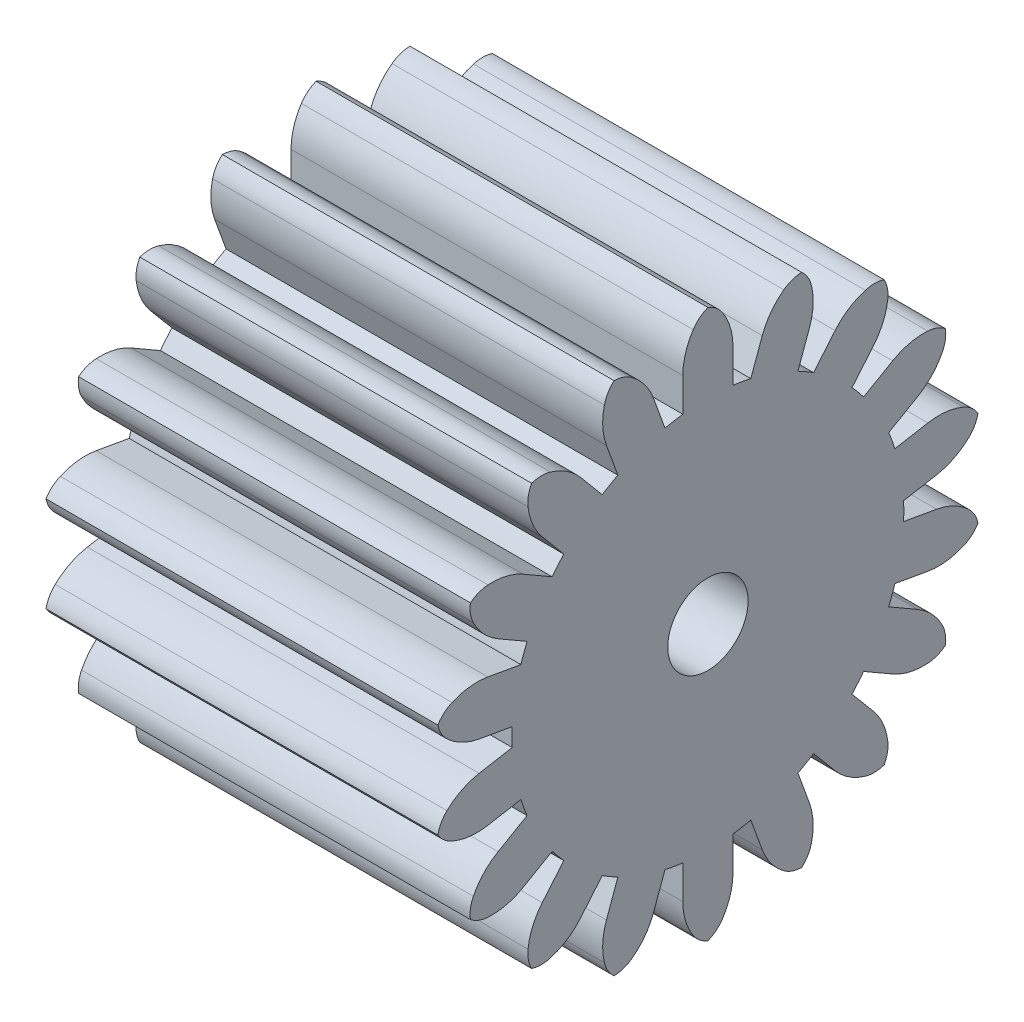
from build123d import *

# Parameters (mm, degrees)
SKETCH1_R           = 5
SKETCH1_R_2         = 1.025
BOSS_EXTRUDE1_DEPTH = 10


with BuildPart() as part:
    # Sketch1 → Boss-Extrude1 (new body)
    # profile 1 of 20: a face of its own
    with BuildSketch(Plane(origin=(0, 0, 0), x_dir=(0, 0, -1), z_dir=(1, 0, 0))):
        Circle(SKETCH1_R)
        Circle(SKETCH1_R_2, mode=Mode.SUBTRACT)
    # profile 2 of 20: a face of its own
    with BuildSketch(Plane(origin=(0, 0, 0), x_dir=(0, 0, -1), z_dir=(1, 0, 0))):
        with BuildLine():
            ThreePointArc((-3.677769177, 3.38733138), (-3.213938048, 3.830222216), (-2.69723229, 4.210099521))
            Line((-2.69723229, 4.210099521), (-3.247176685, 4.86549773))
            ThreePointArc((-3.247176685, 4.86549773), (-3.59498536, 5.174706252), (-4.017062837, 5.370745503))
            ThreePointArc((-4.017062837, 5.370745503), (-4.258939115, 5.403769303), (-4.499513268, 5.362311102))
            ThreePointArc((-4.499513268, 5.362311102), (-4.582116889, 5.132590952), (-4.59159617, 4.888654796))
            ThreePointArc((-4.59159617, 4.888654796), (-4.47182818, 4.438947765), (-4.227713572, 4.042729589))
            Line((-4.227713572, 4.042729589), (-3.677769177, 3.38733138))
        make_face()
    # profile 3 of 20: a face of its own
    with BuildSketch(Plane(origin=(0, 0, 0), x_dir=(0, 0, -1), z_dir=(1, 0, 0))):
        with BuildLine():
            ThreePointArc((-2.297436992, 4.440921443), (-1.710100717, 4.698463104), (-1.094630438, 4.878707227))
            Line((-1.094630438, 4.878707227), (-1.387249739, 5.682672148))
            ThreePointArc((-1.387249739, 5.682672148), (-1.60832744, 6.092190688), (-1.937901159, 6.420766325))
            ThreePointArc((-1.937901159, 6.420766325), (-2.153895708, 6.534525105), (-2.394141003, 6.577848346))
            ThreePointArc((-2.394141003, 6.577848346), (-2.550331935, 6.390234118), (-2.642670624, 6.164251217))
            ThreePointArc((-2.642670624, 6.164251217), (-2.683934392, 5.700701774), (-2.590056293, 5.244886365))
            Line((-2.590056293, 5.244886365), (-2.297436992, 4.440921443))
        make_face()
    # profile 4 of 20: a face of its own
    with BuildSketch(Plane(origin=(0, 0, 0), x_dir=(0, 0, -1), z_dir=(1, 0, 0))):
        with BuildLine():
            Line((1.387249739, 5.682672148), (1.094630438, 4.878707227))
            ThreePointArc((1.094630438, 4.878707227), (1.710100717, 4.698463104), (2.297436992, 4.440921443))
            Line((2.297436992, 4.440921443), (2.590056293, 5.244886365))
            ThreePointArc((2.590056293, 5.244886365), (2.683934392, 5.700701774), (2.642670624, 6.164251217))
            ThreePointArc((2.642670624, 6.164251217), (2.550331935, 6.390234118), (2.394141003, 6.577848346))
            ThreePointArc((2.394141003, 6.577848346), (2.153895708, 6.534525105), (1.937901159, 6.420766325))
            ThreePointArc((1.937901159, 6.420766325), (1.60832744, 6.092190688), (1.387249739, 5.682672148))
        make_face()
    # profile 5 of 20: a face of its own
    with BuildSketch(Plane(origin=(0, 0, 0), x_dir=(0, 0, -1), z_dir=(1, 0, 0))):
        with BuildLine():
            Line((3.247176685, 4.86549773), (2.69723229, 4.210099521))
            ThreePointArc((2.69723229, 4.210099521), (3.213938048, 3.830222216), (3.677769177, 3.38733138))
            Line((3.677769177, 3.38733138), (4.227713572, 4.042729589))
            ThreePointArc((4.227713572, 4.042729589), (4.47182818, 4.438947765), (4.59159617, 4.888654796))
            ThreePointArc((4.59159617, 4.888654796), (4.582116889, 5.132590952), (4.499513268, 5.362311102))
            ThreePointArc((4.499513268, 5.362311102), (4.258939115, 5.403769303), (4.017062837, 5.370745503))
            ThreePointArc((4.017062837, 5.370745503), (3.59498536, 5.174706252), (3.247176685, 4.86549773))
        make_face()
    # profile 6 of 20: a face of its own
    with BuildSketch(Plane(origin=(0, 0, 0), x_dir=(0, 0, -1), z_dir=(1, 0, 0))):
        with BuildLine():
            Line((4.7154462, 3.461472478), (3.974508121, 3.033691678))
            ThreePointArc((3.974508121, 3.033691678), (4.330127019, 2.5), (4.614508121, 1.925179161))
            Line((4.614508121, 1.925179161), (5.3554462, 2.352959961))
            ThreePointArc((5.3554462, 2.352959961), (5.720353493, 2.641791144), (5.986707452, 3.023414457))
            ThreePointArc((5.986707452, 3.023414457), (6.061230921, 3.255881569), (6.062177826, 3.5))
            ThreePointArc((6.062177826, 3.5), (5.85029161, 3.621239171), (5.611707452, 3.67293351))
            ThreePointArc((5.611707452, 3.67293351), (5.148034989, 3.633075872), (4.7154462, 3.461472478))
        make_face()
    # profile 7 of 20: a face of its own
    with BuildSketch(Plane(origin=(0, 0, 0), x_dir=(0, 0, -1), z_dir=(1, 0, 0))):
        with BuildLine():
            Line((5.614963311, 1.639942559), (4.772399615, 1.491375846))
            ThreePointArc((4.772399615, 1.491375846), (4.924038765, 0.868240888), (4.994669282, 0.230821923))
            Line((4.994669282, 0.230821923), (5.837232978, 0.379388635))
            ThreePointArc((5.837232978, 0.379388635), (6.278919752, 0.525995522), (6.659733462, 0.793505714))
            ThreePointArc((6.659733462, 0.793505714), (6.80927105, 0.986464816), (6.893654271, 1.215537244))
            ThreePointArc((6.893654271, 1.215537244), (6.736012596, 1.401934152), (6.529497328, 1.532111529))
            ThreePointArc((6.529497328, 1.532111529), (6.080155621, 1.653242923), (5.614963311, 1.639942559))
        make_face()
    # profile 8 of 20: a face of its own
    with BuildSketch(Plane(origin=(0, 0, 0), x_dir=(0, 0, -1), z_dir=(1, 0, 0))):
        with BuildLine():
            Line((5.837232978, -0.379388635), (4.994669282, -0.230821923))
            ThreePointArc((4.994669282, -0.230821923), (4.924038765, -0.868240888), (4.772399615, -1.491375846))
            Line((4.772399615, -1.491375846), (5.614963311, -1.639942559))
            ThreePointArc((5.614963311, -1.639942559), (6.080155621, -1.653242923), (6.529497328, -1.532111529))
            ThreePointArc((6.529497328, -1.532111529), (6.736012596, -1.401934152), (6.893654271, -1.215537244))
            ThreePointArc((6.893654271, -1.215537244), (6.80927105, -0.986464816), (6.659733462, -0.793505714))
            ThreePointArc((6.659733462, -0.793505714), (6.278919752, -0.525995522), (5.837232978, -0.379388635))
        make_face()
    # profile 9 of 20: a face of its own
    with BuildSketch(Plane(origin=(0, 0, 0), x_dir=(0, 0, -1), z_dir=(1, 0, 0))):
        with BuildLine():
            Line((5.3554462, -2.352959961), (4.614508121, -1.925179161))
            ThreePointArc((4.614508121, -1.925179161), (4.330127019, -2.5), (3.974508121, -3.033691678))
            Line((3.974508121, -3.033691678), (4.7154462, -3.461472478))
            ThreePointArc((4.7154462, -3.461472478), (5.148034989, -3.633075872), (5.611707452, -3.67293351))
            ThreePointArc((5.611707452, -3.67293351), (5.85029161, -3.621239171), (6.062177826, -3.5))
            ThreePointArc((6.062177826, -3.5), (6.061230921, -3.255881569), (5.986707452, -3.023414457))
            ThreePointArc((5.986707452, -3.023414457), (5.720353493, -2.641791144), (5.3554462, -2.352959961))
        make_face()
    # profile 10 of 20: a face of its own
    with BuildSketch(Plane(origin=(0, 0, 0), x_dir=(0, 0, -1), z_dir=(1, 0, 0))):
        with BuildLine():
            Line((4.227713572, -4.042729589), (3.677769177, -3.38733138))
            ThreePointArc((3.677769177, -3.38733138), (3.213938048, -3.830222216), (2.69723229, -4.210099521))
            Line((2.69723229, -4.210099521), (3.247176685, -4.86549773))
            ThreePointArc((3.247176685, -4.86549773), (3.59498536, -5.174706252), (4.017062837, -5.370745503))
            ThreePointArc((4.017062837, -5.370745503), (4.258939115, -5.403769303), (4.499513268, -5.362311102))
            ThreePointArc((4.499513268, -5.362311102), (4.582116889, -5.132590952), (4.59159617, -4.888654796))
            ThreePointArc((4.59159617, -4.888654796), (4.47182818, -4.438947765), (4.227713572, -4.042729589))
        make_face()
    # profile 11 of 20: a face of its own
    with BuildSketch(Plane(origin=(0, 0, 0), x_dir=(0, 0, -1), z_dir=(1, 0, 0))):
        with BuildLine():
            Line((2.590056293, -5.244886365), (2.297436992, -4.440921443))
            ThreePointArc((2.297436992, -4.440921443), (1.710100717, -4.698463104), (1.094630438, -4.878707227))
            Line((1.094630438, -4.878707227), (1.387249739, -5.682672148))
            ThreePointArc((1.387249739, -5.682672148), (1.60832744, -6.092190688), (1.937901159, -6.420766325))
            ThreePointArc((1.937901159, -6.420766325), (2.153895708, -6.534525105), (2.394141003, -6.577848346))
            ThreePointArc((2.394141003, -6.577848346), (2.550331935, -6.390234118), (2.642670624, -6.164251217))
            ThreePointArc((2.642670624, -6.164251217), (2.683934392, -5.700701774), (2.590056293, -5.244886365))
        make_face()
    # profile 12 of 20: a face of its own
    with BuildSketch(Plane(origin=(0, 0, 0), x_dir=(0, 0, -1), z_dir=(1, 0, 0))):
        with BuildLine():
            ThreePointArc((0.64, -4.958870839), (0, -5), (-0.64, -4.958870839))
            Line((-0.64, -4.958870839), (-0.64, -5.814432438))
            ThreePointArc((-0.64, -5.814432438), (-0.572318505, -6.274867016), (-0.375, -6.696347967))
            ThreePointArc((-0.375, -6.696347967), (-0.21093931, -6.87712074), (0, -7))
            ThreePointArc((0, -7), (0.21093931, -6.87712074), (0.375, -6.696347967))
            ThreePointArc((0.375, -6.696347967), (0.572318505, -6.274867016), (0.64, -5.814432438))
            Line((0.64, -5.814432438), (0.64, -4.958870839))
        make_face()
    # profile 13 of 20: a face of its own
    with BuildSketch(Plane(origin=(0, 0, 0), x_dir=(0, 0, -1), z_dir=(1, 0, 0))):
        with BuildLine():
            ThreePointArc((-1.094630438, -4.878707227), (-1.710100717, -4.698463104), (-2.297436992, -4.440921443))
            Line((-2.297436992, -4.440921443), (-2.590056293, -5.244886365))
            ThreePointArc((-2.590056293, -5.244886365), (-2.683934392, -5.700701774), (-2.642670624, -6.164251217))
            ThreePointArc((-2.642670624, -6.164251217), (-2.550331935, -6.390234118), (-2.394141003, -6.577848346))
            ThreePointArc((-2.394141003, -6.577848346), (-2.153895708, -6.534525105), (-1.937901159, -6.420766325))
            ThreePointArc((-1.937901159, -6.420766325), (-1.60832744, -6.092190688), (-1.387249739, -5.682672148))
            Line((-1.387249739, -5.682672148), (-1.094630438, -4.878707227))
        make_face()
    # profile 14 of 20: a face of its own
    with BuildSketch(Plane(origin=(0, 0, 0), x_dir=(0, 0, -1), z_dir=(1, 0, 0))):
        with BuildLine():
            ThreePointArc((-2.69723229, -4.210099521), (-3.213938048, -3.830222216), (-3.677769177, -3.38733138))
            Line((-3.677769177, -3.38733138), (-4.227713572, -4.042729589))
            ThreePointArc((-4.227713572, -4.042729589), (-4.47182818, -4.438947765), (-4.59159617, -4.888654796))
            ThreePointArc((-4.59159617, -4.888654796), (-4.582116889, -5.132590952), (-4.499513268, -5.362311102))
            ThreePointArc((-4.499513268, -5.362311102), (-4.258939115, -5.403769303), (-4.017062837, -5.370745503))
            ThreePointArc((-4.017062837, -5.370745503), (-3.59498536, -5.174706252), (-3.247176685, -4.86549773))
            Line((-3.247176685, -4.86549773), (-2.69723229, -4.210099521))
        make_face()
    # profile 15 of 20: a face of its own
    with BuildSketch(Plane(origin=(0, 0, 0), x_dir=(0, 0, -1), z_dir=(1, 0, 0))):
        with BuildLine():
            ThreePointArc((-3.974508121, -3.033691678), (-4.330127019, -2.5), (-4.614508121, -1.925179161))
            Line((-4.614508121, -1.925179161), (-5.3554462, -2.352959961))
            ThreePointArc((-5.3554462, -2.352959961), (-5.720353493, -2.641791144), (-5.986707452, -3.023414457))
            ThreePointArc((-5.986707452, -3.023414457), (-6.061230921, -3.255881569), (-6.062177826, -3.5))
            ThreePointArc((-6.062177826, -3.5), (-5.85029161, -3.621239171), (-5.611707452, -3.67293351))
            ThreePointArc((-5.611707452, -3.67293351), (-5.148034989, -3.633075872), (-4.7154462, -3.461472478))
            Line((-4.7154462, -3.461472478), (-3.974508121, -3.033691678))
        make_face()
    # profile 16 of 20: a face of its own
    with BuildSketch(Plane(origin=(0, 0, 0), x_dir=(0, 0, -1), z_dir=(1, 0, 0))):
        with BuildLine():
            ThreePointArc((-4.772399615, -1.491375846), (-4.924038765, -0.868240888), (-4.994669282, -0.230821923))
            Line((-4.994669282, -0.230821923), (-5.837232978, -0.379388635))
            ThreePointArc((-5.837232978, -0.379388635), (-6.278919752, -0.525995522), (-6.659733462, -0.793505714))
            ThreePointArc((-6.659733462, -0.793505714), (-6.80927105, -0.986464816), (-6.893654271, -1.215537244))
            ThreePointArc((-6.893654271, -1.215537244), (-6.736012596, -1.401934152), (-6.529497328, -1.532111529))
            ThreePointArc((-6.529497328, -1.532111529), (-6.080155621, -1.653242923), (-5.614963311, -1.639942559))
            Line((-5.614963311, -1.639942559), (-4.772399615, -1.491375846))
        make_face()
    # profile 17 of 20: a face of its own
    with BuildSketch(Plane(origin=(0, 0, 0), x_dir=(0, 0, -1), z_dir=(1, 0, 0))):
        with BuildLine():
            ThreePointArc((-4.994669282, 0.230821923), (-4.924038765, 0.868240888), (-4.772399615, 1.491375846))
            Line((-4.772399615, 1.491375846), (-5.614963311, 1.639942559))
            ThreePointArc((-5.614963311, 1.639942559), (-6.080155621, 1.653242923), (-6.529497328, 1.532111529))
            ThreePointArc((-6.529497328, 1.532111529), (-6.736012596, 1.401934152), (-6.893654271, 1.215537244))
            ThreePointArc((-6.893654271, 1.215537244), (-6.80927105, 0.986464816), (-6.659733462, 0.793505714))
            ThreePointArc((-6.659733462, 0.793505714), (-6.278919752, 0.525995522), (-5.837232978, 0.379388635))
            Line((-5.837232978, 0.379388635), (-4.994669282, 0.230821923))
        make_face()
    # profile 18 of 20: a face of its own
    with BuildSketch(Plane(origin=(0, 0, 0), x_dir=(0, 0, -1), z_dir=(1, 0, 0))):
        with BuildLine():
            ThreePointArc((-4.614508121, 1.925179161), (-4.330127019, 2.5), (-3.974508121, 3.033691678))
            Line((-3.974508121, 3.033691678), (-4.7154462, 3.461472478))
            ThreePointArc((-4.7154462, 3.461472478), (-5.148034989, 3.633075872), (-5.611707452, 3.67293351))
            ThreePointArc((-5.611707452, 3.67293351), (-5.85029161, 3.621239171), (-6.062177826, 3.5))
            ThreePointArc((-6.062177826, 3.5), (-6.061230921, 3.255881569), (-5.986707452, 3.023414457))
            ThreePointArc((-5.986707452, 3.023414457), (-5.720353493, 2.641791144), (-5.3554462, 2.352959961))
            Line((-5.3554462, 2.352959961), (-4.614508121, 1.925179161))
        make_face()
    # profile 19 of 20: a face of its own
    with BuildSketch(Plane(origin=(0, 0, 0), x_dir=(0, 0, -1), z_dir=(1, 0, 0))):
        with BuildLine():
            Line((-0.64, 5.814432438), (-0.64, 4.958870839))
            ThreePointArc((-0.64, 4.958870839), (-0.320660103, 4.989707115), (0, 5))
            Line((0, 5), (0, 7))
            ThreePointArc((0, 7), (-0.21093931, 6.87712074), (-0.375, 6.696347967))
            ThreePointArc((-0.375, 6.696347967), (-0.572318505, 6.274867016), (-0.64, 5.814432438))
        make_face()
    # profile 20 of 20: a face of its own
    with BuildSketch(Plane(origin=(0, 0, 0), x_dir=(0, 0, -1), z_dir=(1, 0, 0))):
        with BuildLine():
            Line((0, 7), (0, 5))
            ThreePointArc((0, 5), (0.320660103, 4.989707115), (0.64, 4.958870839))
            Line((0.64, 4.958870839), (0.64, 5.814432438))
            ThreePointArc((0.64, 5.814432438), (0.572318505, 6.274867016), (0.375, 6.696347967))
            ThreePointArc((0.375, 6.696347967), (0.21093931, 6.87712074), (0, 7))
        make_face()
    extrude(amount=BOSS_EXTRUDE1_DEPTH)


solid = part.part
